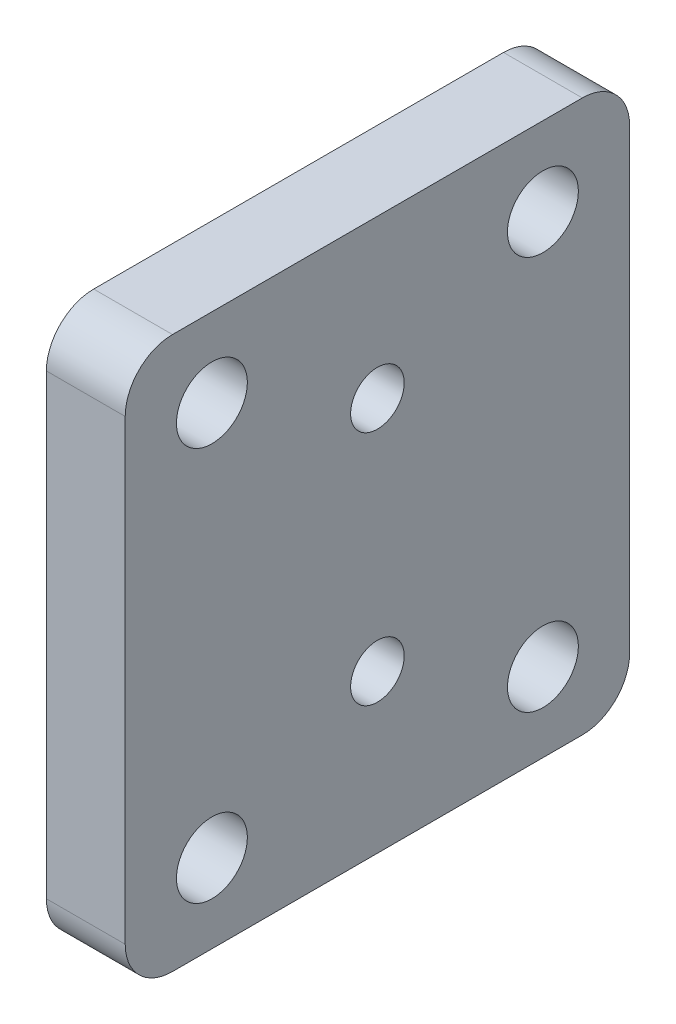
from build123d import *

# Parameters (mm, degrees)
SKETCH_1_W      = 32
SKETCH_1_H      = 35
SKETCH_1_R      = 2.25
SKETCH_1_R_2    = 3
EXTRUDE_1_DEPTH = 2.5
SKETCH_2_W      = 32
SKETCH_2_H      = 35
SKETCH_2_R      = 2.25
SKETCH_2_R_2    = 1.7
EXTRUDE_2_DEPTH = 2.5
FILLET_1_R      = 3


with BuildPart() as part:
    # 草图1 → 凸台-拉伸1 (new body)
    with BuildSketch(Plane(origin=(0, 0, 0), x_dir=(0, 0, -1), z_dir=(1, 0, 0))):
        with Locations((16, 17.5)):
            Rectangle(SKETCH_1_W, SKETCH_1_H)
        with Locations((5.5, 30)):
            Circle(SKETCH_1_R, mode=Mode.SUBTRACT)
        with Locations((26.5, 30)):
            Circle(SKETCH_1_R, mode=Mode.SUBTRACT)
        with Locations((5.5, 5)):
            Circle(SKETCH_1_R, mode=Mode.SUBTRACT)
        with Locations((26.5, 5)):
            Circle(SKETCH_1_R, mode=Mode.SUBTRACT)
        with Locations((16, 25)):
            Circle(SKETCH_1_R_2, mode=Mode.SUBTRACT)
        with Locations((16, 10)):
            Circle(SKETCH_1_R_2, mode=Mode.SUBTRACT)
    extrude(amount=EXTRUDE_1_DEPTH)

    # 草图2 → 凸台-拉伸2 (add)
    with BuildSketch(Plane(origin=(2.5, 0, 0), x_dir=(0, 0, -1), z_dir=(1, 0, 0))):
        with Locations((16, 17.5)):
            Rectangle(SKETCH_2_W, SKETCH_2_H)
        with Locations((26.5, 5)):
            Circle(SKETCH_2_R, mode=Mode.SUBTRACT)
        with Locations((5.5, 5)):
            Circle(SKETCH_2_R, mode=Mode.SUBTRACT)
        with Locations((26.5, 30)):
            Circle(SKETCH_2_R, mode=Mode.SUBTRACT)
        with Locations((5.5, 30)):
            Circle(SKETCH_2_R, mode=Mode.SUBTRACT)
        with Locations((16, 25)):
            Circle(SKETCH_2_R_2, mode=Mode.SUBTRACT)
        with Locations((16, 10)):
            Circle(SKETCH_2_R_2, mode=Mode.SUBTRACT)
    extrude(amount=EXTRUDE_2_DEPTH)

    # 圆角1
    fillet_1_edges = [part.edges().sort_by_distance(p)[0] for p in [
        (2.5, 35, 0),
        (2.5, 35, -32),
        (2.5, 0, -32),
        (2.5, 0, 0),
    ]]
    fillet(fillet_1_edges, radius=FILLET_1_R)


solid = part.part
